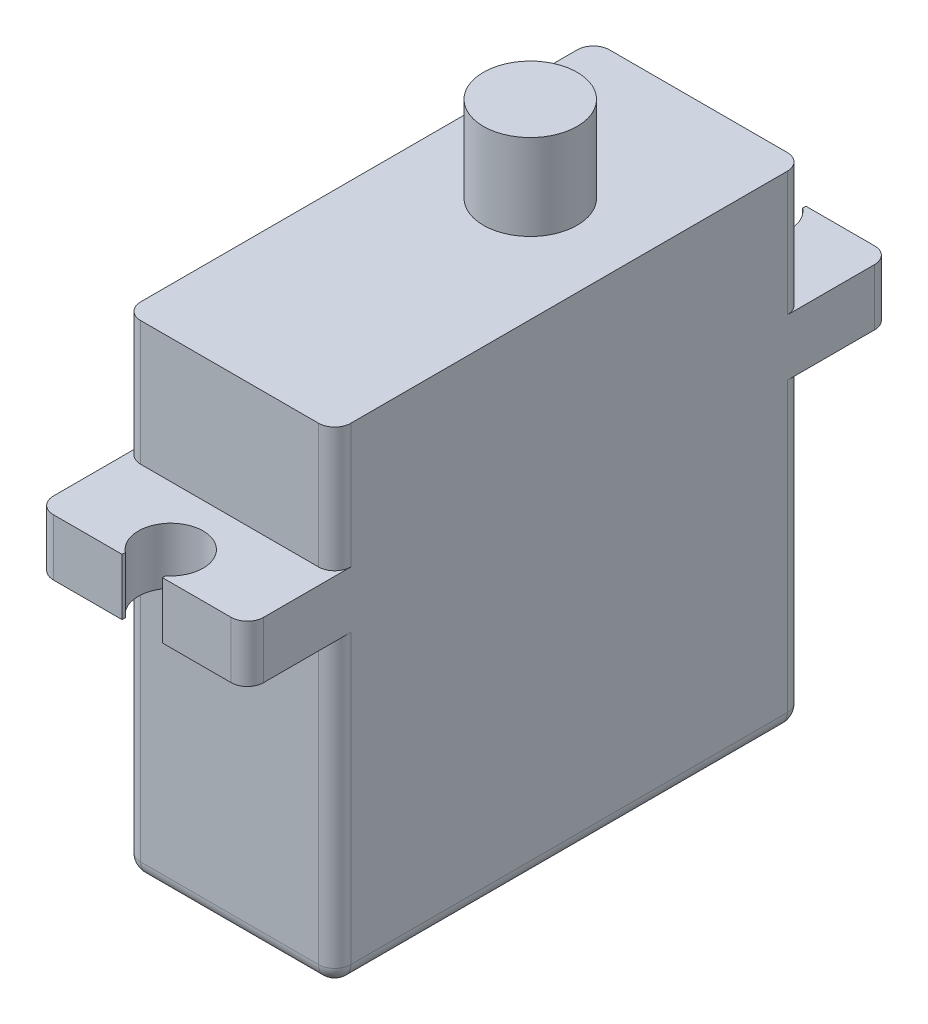
from build123d import *

# Parameters (mm, degrees)
SKETCH2_W           = 29
SKETCH2_H           = 30
SKETCH2_W_2         = 5.4
SKETCH2_H_2         = 3.5
SKETCH2_W_3         = 5.8
SKETCH2_H_3         = 5.3
BOSS_EXTRUDE1_DEPTH = 13
CUT_EXTRUDE1_DEPTH  = 5.3
CUT_EXTRUDE2_DEPTH  = 39.27544905
FILLET1_R           = 1


with BuildPart() as part:
    # Sketch2 → Boss-Extrude1 (new body)
    with BuildSketch(Plane(origin=(0, 0, 0), x_dir=(0, 0, -1), z_dir=(1, 0, 0))):
        Rectangle(SKETCH2_W, SKETCH2_H)
        with Locations((-17.2, 5.55)):
            Rectangle(SKETCH2_W_2, SKETCH2_H_2)
        with Locations((4.1, 17.65)):
            Rectangle(SKETCH2_W_3, SKETCH2_H_3)
        with Locations((17.2, 5.55)):
            Rectangle(SKETCH2_W_2, SKETCH2_H_2)
    extrude(amount=BOSS_EXTRUDE1_DEPTH)

    # Sketch3 → Cut-Extrude1 (cut)
    with BuildSketch(Plane(origin=(0, 15, 0), x_dir=(1, 0, 0), z_dir=(0, 1, 0))):
        with BuildLine():
            Line((6.5, 1.2), (9.4, 1.2))
            Line((9.4, 1.2), (9.4, 4.1))
            ThreePointArc((9.4, 4.1), (8.550609665, 2.049390335), (6.5, 1.2))
        make_face()
        with BuildLine():
            ThreePointArc((6.5, 7), (8.550609665, 6.150609665), (9.4, 4.1))
            Line((9.4, 4.1), (9.4, 7))
            Line((9.4, 7), (6.5, 7))
        make_face()
        with BuildLine():
            ThreePointArc((3.6, 4.1), (4.449390335, 6.150609665), (6.5, 7))
            Line((6.5, 7), (3.6, 7))
            Line((3.6, 7), (3.6, 4.1))
        make_face()
        with BuildLine():
            Line((3.6, 1.2), (6.5, 1.2))
            ThreePointArc((6.5, 1.2), (4.449390335, 2.049390335), (3.6, 4.1))
            Line((3.6, 4.1), (3.6, 1.2))
        make_face()
        Polygon((0, 1.2), (3.6, 1.2), (3.6, 4.1), (3.6, 7), (0, 7), align=None)
        Polygon((9.4, 1.2), (13, 1.2), (13, 7), (9.4, 7), (9.4, 4.1), align=None)
        with BuildLine():
            Line((7.75, 19.7), (7.75, 19.9))
            Line((7.75, 19.9), (5.25, 19.9))
            Line((5.25, 19.9), (5.25, 19.7))
            ThreePointArc((5.25, 19.7), (6.5, 16.1387505), (7.75, 19.7))
        make_face()
        with BuildLine():
            Line((5.25, -19.9), (7.75, -19.9))
            Line((7.75, -19.9), (7.75, -19.7))
            ThreePointArc((7.75, -19.7), (6.5, -16.1387505), (5.25, -19.7))
            Line((5.25, -19.7), (5.25, -19.9))
        make_face()
    extrude(amount=CUT_EXTRUDE1_DEPTH, mode=Mode.SUBTRACT)

    # Sketch3<4> → Cut-Extrude2 (cut, through all)
    with BuildSketch(Plane(origin=(0, 15, 0), x_dir=(1, 0, 0), z_dir=(0, 1, 0))):
        with BuildLine():
            Line((7.75, 19.7), (7.75, 19.9))
            Line((7.75, 19.9), (5.25, 19.9))
            Line((5.25, 19.9), (5.25, 19.7))
            ThreePointArc((5.25, 19.7), (6.5, 16.1387505), (7.75, 19.7))
        make_face()
        with BuildLine():
            Line((5.25, -19.9), (7.75, -19.9))
            Line((7.75, -19.9), (7.75, -19.7))
            ThreePointArc((7.75, -19.7), (6.5, -16.1387505), (5.25, -19.7))
            Line((5.25, -19.7), (5.25, -19.9))
        make_face()
    extrude(amount=-CUT_EXTRUDE2_DEPTH, mode=Mode.SUBTRACT)

    # Fillet1
    fillet1_edges = [part.edges().sort_by_distance(p)[0] for p in [
        (0, 5.55, -19.9),
        (0, -5.6, -14.5),
        (0, -15, 0),
        (0, -5.6, 14.5),
        (0, 5.55, 19.9),
        (0, 11.15, 14.5),
        (0, 11.15, -14.5),
        (6.5, -15, -14.5),
        (6.5, -15, 14.5),
        (13, 11.15, 14.5),
        (13, 5.55, 19.9),
        (13, 11.15, -14.5),
        (13, -5.6, 14.5),
        (13, -15, 0),
        (13, -5.6, -14.5),
        (13, 5.55, -19.9),
    ]]
    fillet(fillet1_edges, radius=FILLET1_R)


solid = part.part
